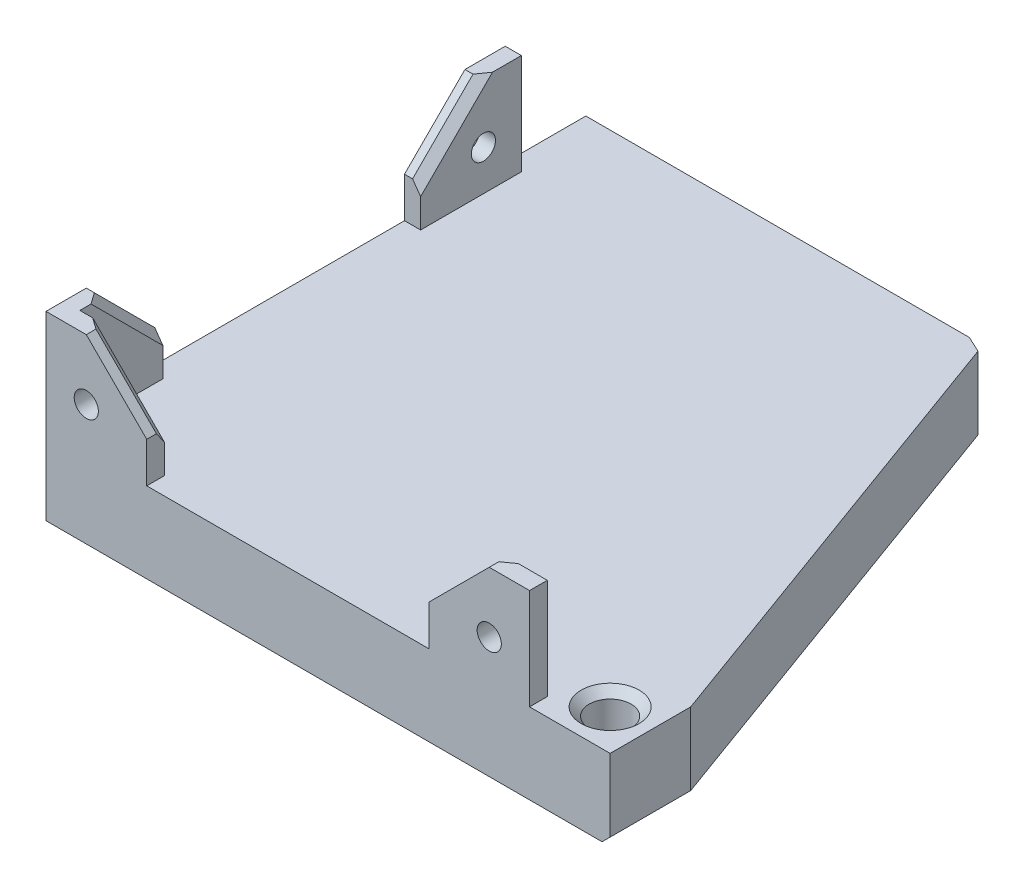
from build123d import *

# Parameters (mm, degrees)
SKETCH1_W           = 10.000000000000004
SKETCH1_H           = 10
SKETCH1_W_2         = 10
BOSS_EXTRUDE1_DEPTH = 10
SKETCH2_W           = 1.999999999999993
SKETCH2_H           = 10.29963091051744
SKETCH2_H_2         = 12.500000000000014
BOSS_EXTRUDE2_DEPTH = 12.5
SKETCH3_R           = 1.5000000000000002
SKETCH3_R_2         = 1.5000000000000042
CUT_EXTRUDE1_DEPTH  = 2.200369089
CHAMFER1_SIZE       = 7.5
CHAMFER2_SIZE       = 1
SKETCH4_R           = 1.4999999999999998
SKETCH4_R_2         = 1.5000000000000042
CUT_EXTRUDE2_DEPTH  = 2
CHAMFER3_SIZE       = 7.5
CHAMFER4_SIZE       = 1
CHAMFER5_SIZE       = 1
SKETCH5_R           = 2.6000000000000005
CUT_EXTRUDE3_DEPTH  = 5
CHAMFER6_SIZE       = 1
CHAMFER7_SIZE       = 1
CHAMFER7_SIZE2      = 1.6731571851015008


with BuildPart() as part:
    # Sketch1 → Boss-Extrude1 (new body)
    with BuildSketch(Plane(origin=(0, 0, 0), x_dir=(1, 0, 0), z_dir=(0, 1, 0))):
        Polygon((-12.101007166283637, 51.98463103929535), (-15.740709508945708, 61.984631039295344), (-22.10100716628364, 61.984631039295344), (-22.10100716628364, 51.984631039295344), (-5, 5.000000000000001), (5, 5.000000000000001), align=None)
        with Locations((-27.101007166283644, 56.98463103929535)):
            Rectangle(SKETCH1_W, SKETCH1_H)
        Polygon((-65, 61.984631039295344), (-32.101007166283644, 61.984631039295344), (-32.101007166283644, 51.984631039295344), (-22.10100716628364, 51.984631039295344), (-5, 5.000000000000001), (-5, -5), (-65, -5.000000000000009), align=None)
        Rectangle(SKETCH1_W_2, SKETCH1_H)
    extrude(amount=BOSS_EXTRUDE1_DEPTH)

    # Sketch2 → Boss-Extrude2 (add)
    with BuildSketch(Plane(origin=(0, 10, 0), x_dir=(1, 0, 0), z_dir=(0, 1, 0))):
        with Locations((-64, 2.3501845447412815)):
            Rectangle(SKETCH2_W, SKETCH2_H)
        Polygon((-65, -5.000000000000009), (-63, -5.000000000000007), (-63, -2.799630910517438), (-65, -2.799630910517438), align=None)
        Polygon((-63, -5.000000000000007), (-52.50000000000001, -5), (-52.50000000000001, -2.799630910517438), (-63, -2.799630910517438), align=None)
        Polygon((-17.5, -2.799630910517445), (-17.5, -5), (-5, -5), (-5.000000000000001, -2.799630910517445), align=None)
        with Locations((-64, 45.734631039295344)):
            Rectangle(SKETCH2_W, SKETCH2_H_2)
    extrude(amount=BOSS_EXTRUDE2_DEPTH)

    # Sketch3 → Cut-Extrude1 (cut)
    with BuildSketch(Plane(origin=(0, 0, 2.799630910517438), x_dir=(-1, 0, 0), z_dir=(0, 0, -1))):
        with Locations((10.000000000000002, 15)):
            Circle(SKETCH3_R)
        with Locations((60.00000000000001, 15.000000000000002)):
            Circle(SKETCH3_R_2)
    extrude(amount=-CUT_EXTRUDE1_DEPTH, mode=Mode.SUBTRACT)

    # Chamfer1
    chamfer1_edges = [part.edges().sort_by_distance(p)[0] for p in [
        (-52.50000000000001, 22.5, 3.899815455258719),
        (-17.5, 22.5, 3.8998154552587225),
    ]]
    chamfer(chamfer1_edges, length=CHAMFER1_SIZE)

    # Chamfer2
    chamfer2_edges = [part.edges().sort_by_distance(p)[0] for p in [
        (-56.25000000000001, 18.75, 2.799630910517438),
        (-13.75, 18.75, 2.799630910517445),
    ]]
    chamfer(chamfer2_edges, length=CHAMFER2_SIZE)

    # Sketch4 → Cut-Extrude2 (cut)
    with BuildSketch(Plane(origin=(-63, 0, 0), x_dir=(0, 0, -1), z_dir=(1, 0, 0))):
        with Locations((0, 15)):
            Circle(SKETCH4_R)
        with Locations((47.27277690959397, 15)):
            Circle(SKETCH4_R_2)
    extrude(amount=-CUT_EXTRUDE2_DEPTH, mode=Mode.SUBTRACT)

    # Chamfer3
    chamfer3_edges = [part.edges().sort_by_distance(p)[0] for p in [
        (-64, 22.5, -7.500000000000001),
        (-64, 22.5, -39.48463103929534),
    ]]
    chamfer(chamfer3_edges, length=CHAMFER3_SIZE)

    # Chamfer4
    chamfer4_edges = [part.edges().sort_by_distance(p)[0] for p in [
        (-63, 18.750000000000004, -43.23463103929534),
        (-63, 18.75, -3.750000000000001),
    ]]
    chamfer(chamfer4_edges, length=CHAMFER4_SIZE)

    # Chamfer5
    chamfer5_edges = [part.edges().sort_by_distance(p)[0] for p in [
        (-5.370354754472853, 0, -33.492315519647676),
        (5, 0, 0),
        (-40.37035475447286, 0, -61.984631039295344),
    ]]
    chamfer(chamfer5_edges, length=CHAMFER5_SIZE)

    # Sketch5 → Cut-Extrude3 (cut)
    with BuildSketch(Plane(origin=(0, 10, 0), x_dir=(1, 0, 0), z_dir=(0, 1, 0))):
        with Locations(Location((0, -4.3e-16, 0), (0, 0, 270))):
            Circle(SKETCH5_R)
    extrude(amount=-CUT_EXTRUDE3_DEPTH, mode=Mode.SUBTRACT)

    # Chamfer6
    chamfer6_edges = [part.edges().sort_by_distance(p)[0] for p in [
        (8e-16, 10, -2.6),
    ]]
    chamfer(chamfer6_edges, length=CHAMFER6_SIZE)

    # Chamfer7
    chamfer7_edges = [part.edges().sort_by_distance(p)[0] for p in [
        (-15.740709508945708, 5.5, -61.984631039295344),
    ]]
    chamfer7_side = [part.faces().sort_by_distance(p)[0] for p in [
        (-5.370354754472848, 5.5, -33.49231551964767),
    ]]
    chamfer(chamfer7_edges, length=CHAMFER7_SIZE, length2=CHAMFER7_SIZE2, reference=chamfer7_side[0])


solid = part.part
